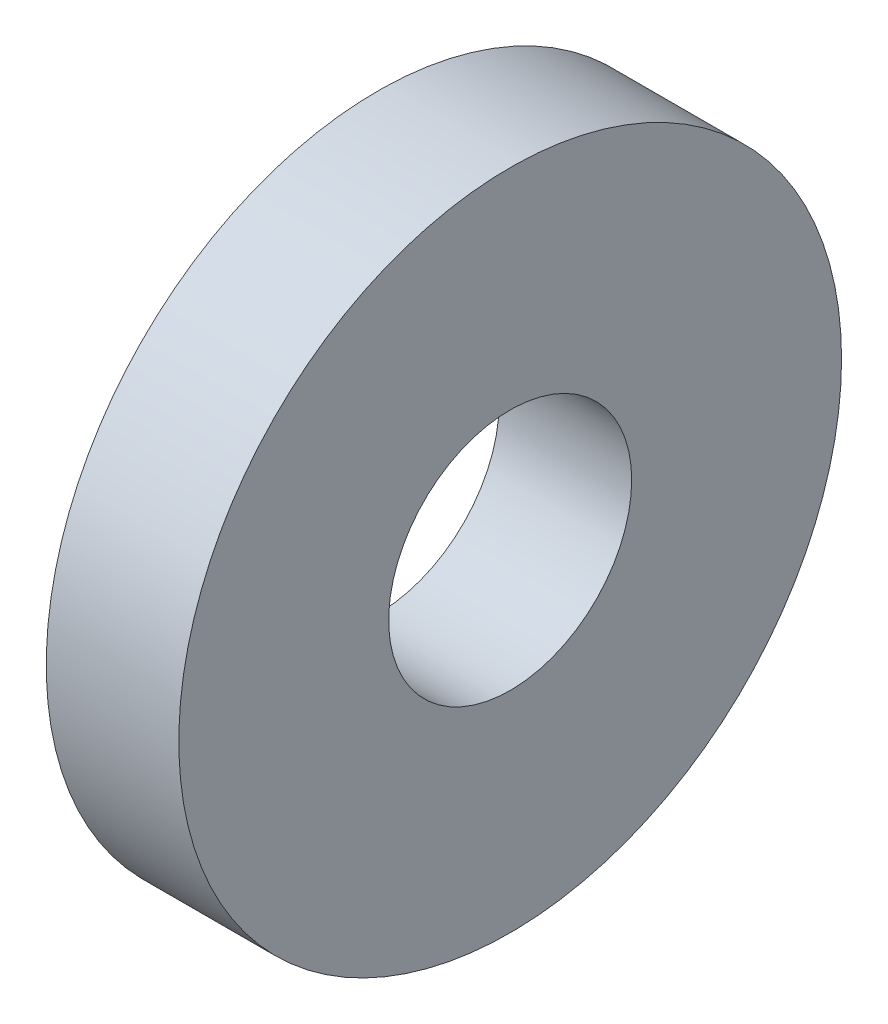
from build123d import *

# Parameters (mm, degrees)
SKETCH_1_R      = 7.5
SKETCH_1_R_2    = 2.75
EXTRUDE_1_DEPTH = 3


with BuildPart() as part:
    # 草图1 → 凸台-拉伸1 (new body)
    with BuildSketch(Plane(origin=(0, 0, 0), x_dir=(0, 0, -1), z_dir=(1, 0, 0))):
        Circle(SKETCH_1_R)
        Circle(SKETCH_1_R_2, mode=Mode.SUBTRACT)
    extrude(amount=EXTRUDE_1_DEPTH)


solid = part.part
